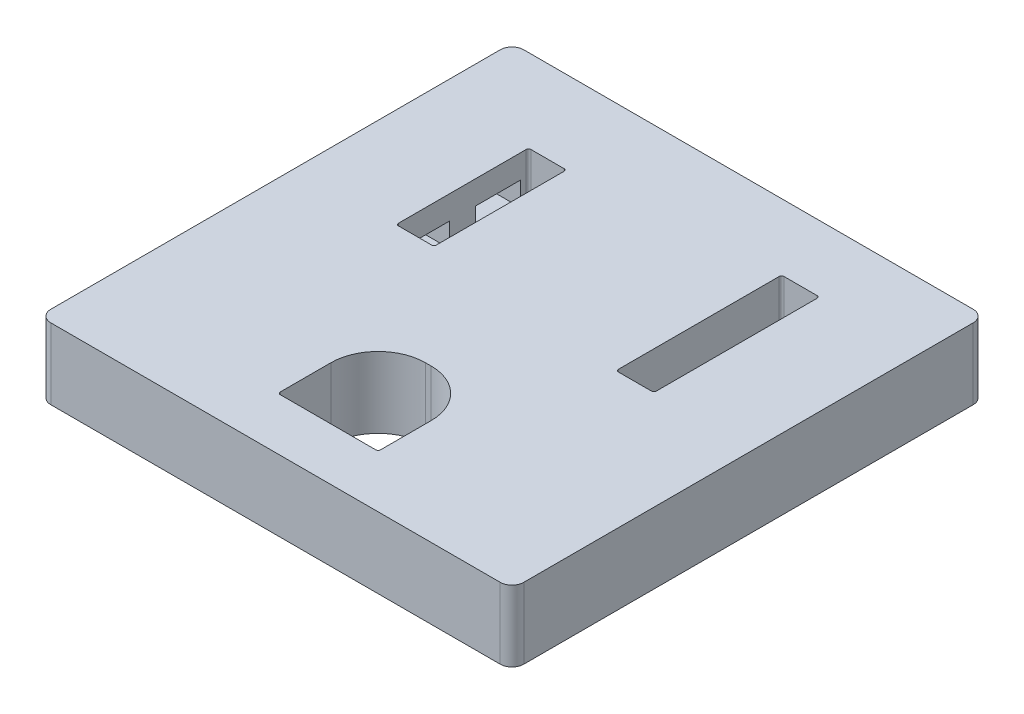
from build123d import *

# Parameters (mm, degrees)
BOSS_EXTRUDE1_DEPTH = 3.81
CUT_EXTRUDE1_DEPTH  = 37.122515139
SKETCH4_W           = 2.413
SKETCH4_H           = 1.27
CUT_EXTRUDE2_DEPTH  = 2.2352
SKETCH6_W           = 2.413
SKETCH6_H           = 1.27
CUT_EXTRUDE3_DEPTH  = 2.2352


with BuildPart() as part:
    # Sketch1 → Boss-Extrude1 (new body)
    with BuildSketch(Plane(origin=(0, 0, 0), x_dir=(1, 0, 0), z_dir=(0, 1, 0))):
        with BuildLine():
            Line((0.635, 0), (24.765, 0))
            ThreePointArc((24.765, 0), (25.214012806, 0.185987194), (25.4, 0.635))
            Line((25.4, 0.635), (25.4, 24.765))
            ThreePointArc((25.4, 24.765), (25.214012806, 25.214012806), (24.765, 25.4))
            Line((24.765, 25.4), (0.635, 25.4))
            ThreePointArc((0.635, 25.4), (0.185987194, 25.214012806), (0, 24.765))
            Line((0, 24.765), (0, 0.635))
            ThreePointArc((0, 0.635), (0.185987194, 0.185987194), (0.635, 0))
        make_face()
    extrude(amount=BOSS_EXTRUDE1_DEPTH)

    # Sketch2 → Cut-Extrude1 (cut, through all)
    with BuildSketch(Plane(origin=(0, 3.81, 0), x_dir=(1, 0, 0), z_dir=(0, 1, 0))):
        with BuildLine():
            Line((10.1346, 2.8194), (15.2654, 2.8194))
            ThreePointArc((15.2654, 2.8194), (15.355202561, 2.856597439), (15.3924, 2.9464))
            Line((15.3924, 2.9464), (15.3924, 5.6642))
            ThreePointArc((15.3924, 5.6642), (14.648451224, 7.460251224), (12.8524, 8.2042))
            Line((12.8524, 8.2042), (12.5476, 8.2042))
            ThreePointArc((12.5476, 8.2042), (10.751548776, 7.460251224), (10.0076, 5.6642))
            Line((10.0076, 5.6642), (10.0076, 2.9464))
            ThreePointArc((10.0076, 2.9464), (10.044797439, 2.856597439), (10.1346, 2.8194))
        make_face()
        with BuildLine():
            Line((5.461, 20.955), (7.239, 20.955))
            ThreePointArc((7.239, 20.955), (7.328802561, 20.917802561), (7.366, 20.828))
            Line((7.366, 20.828), (7.366, 13.97))
            ThreePointArc((7.366, 13.97), (7.328802561, 13.880197439), (7.239, 13.843))
            Line((7.239, 13.843), (5.461, 13.843))
            ThreePointArc((5.461, 13.843), (5.371197439, 13.880197439), (5.334, 13.97))
            Line((5.334, 13.97), (5.334, 14.2875))
            Line((5.334, 14.2875), (5.334, 16.7005))
            Line((5.334, 16.7005), (5.334, 18.0975))
            Line((5.334, 18.0975), (5.334, 20.5105))
            Line((5.334, 20.5105), (5.334, 20.828))
            ThreePointArc((5.334, 20.828), (5.371197439, 20.917802561), (5.461, 20.955))
        make_face()
        with BuildLine():
            Line((18.161, 21.844), (19.939, 21.844))
            ThreePointArc((19.939, 21.844), (20.028802561, 21.806802561), (20.066, 21.717))
            Line((20.066, 21.717), (20.066, 20.5105))
            Line((20.066, 20.5105), (20.066, 18.0975))
            Line((20.066, 18.0975), (20.066, 16.7005))
            Line((20.066, 16.7005), (20.066, 14.2875))
            Line((20.066, 14.2875), (20.066, 13.081))
            ThreePointArc((20.066, 13.081), (20.028802561, 12.991197439), (19.939, 12.954))
            Line((19.939, 12.954), (18.161, 12.954))
            ThreePointArc((18.161, 12.954), (18.071197439, 12.991197439), (18.034, 13.081))
            Line((18.034, 13.081), (18.034, 21.717))
            ThreePointArc((18.034, 21.717), (18.071197439, 21.806802561), (18.161, 21.844))
        make_face()
    extrude(amount=-CUT_EXTRUDE1_DEPTH, mode=Mode.SUBTRACT)

    # Sketch4 → Cut-Extrude2 (cut)
    with BuildSketch(Plane(origin=(5.334, 0, 0), x_dir=(0, 0, -1), z_dir=(1, 0, 0))):
        with Locations((15.494, 1.905)):
            Rectangle(SKETCH4_W, SKETCH4_H)
        with Locations((19.304, 1.905)):
            Rectangle(SKETCH4_W, SKETCH4_H)
    extrude(amount=-CUT_EXTRUDE2_DEPTH, mode=Mode.SUBTRACT)

    # Sketch6 → Cut-Extrude3 (cut)
    with BuildSketch(Plane.ZY.offset(-20.066)):
        with Locations((-15.494, 1.905)):
            Rectangle(SKETCH6_W, SKETCH6_H)
        with Locations((-19.304, 1.905)):
            Rectangle(SKETCH6_W, SKETCH6_H)
    extrude(amount=-CUT_EXTRUDE3_DEPTH, mode=Mode.SUBTRACT)


solid = part.part
